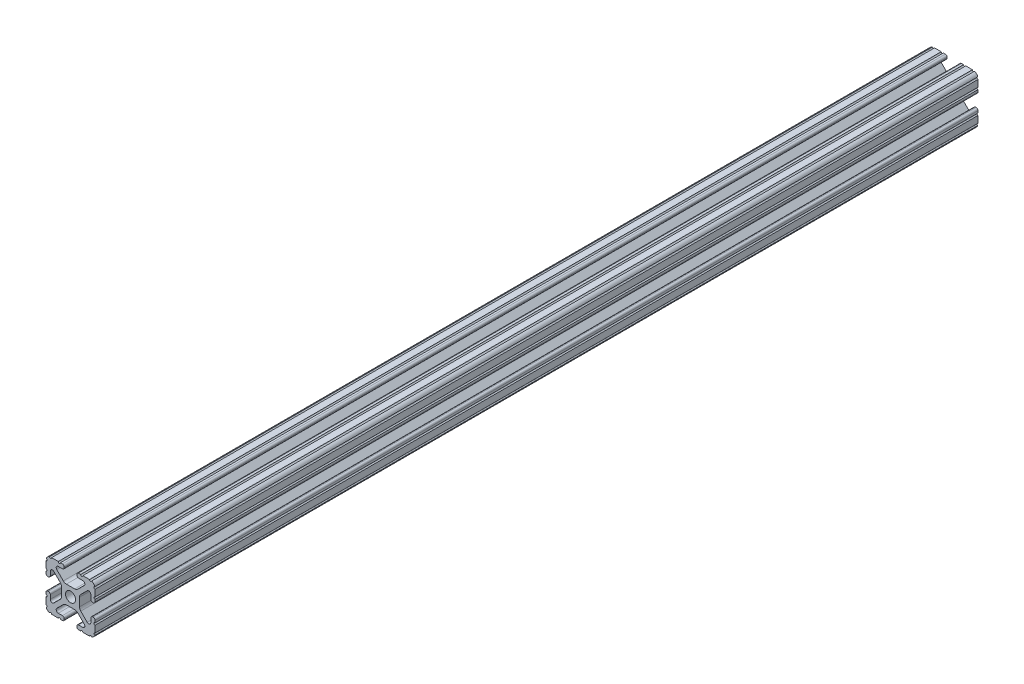
from build123d import *

# Parameters (mm, degrees)
BOSS_EXTRUDE1_DEPTH     = 228.6
CUT_EXTRUDE1_DEPTH      = 230.304470083
CUT_EXTRUDE1_DEPTH_BACK = 230.304470083
SKETCH5_R               = 0.55245


with BuildPart() as part:
    # Sketch4 → Boss-Extrude1 (new, symmetric)
    with BuildSketch(Plane.XY):
        with BuildLine():
            Line((4.190365, -12.7), (10.11729625, -12.7))
            ThreePointArc((10.11729625, -12.7), (11.943543585, -11.943543585), (12.7, -10.11729625))
            Line((12.7, -10.11729625), (12.7, -4.190365))
            ThreePointArc((12.7, -4.190365), (12.42492494, -3.52627506), (11.760835, -3.2512))
            Line((11.760835, -3.2512), (11.429365, -3.2512))
            ThreePointArc((11.429365, -3.2512), (10.76527506, -3.52627506), (10.4902, -4.190365))
            Line((10.4902, -4.190365), (10.4902, -6.348478019))
            ThreePointArc((10.4902, -6.348478019), (9.830707141, -7.335478831), (8.666460301, -7.103895736))
            Line((8.666460301, -7.103895736), (5.299899128, -3.737334563))
            ThreePointArc((5.299899128, -3.737334563), (4.817571085, -3.015479634), (4.6482, -2.16399369))
            Line((4.6482, -2.16399369), (4.6482, 0))
            Line((4.6482, 0), (2.6035, 0))
            ThreePointArc((2.6035, 0), (1.840952505, -1.840952505), (0, -2.6035))
            Line((0, -2.6035), (0, -4.6482))
            Line((0, -4.6482), (2.16399369, -4.6482))
            ThreePointArc((2.16399369, -4.6482), (3.015479634, -4.817571085), (3.737334563, -5.299899128))
            Line((3.737334563, -5.299899128), (7.103895736, -8.666460301))
            ThreePointArc((7.103895736, -8.666460301), (7.335478831, -9.830707141), (6.348478019, -10.4902))
            Line((6.348478019, -10.4902), (4.190365, -10.4902))
            ThreePointArc((4.190365, -10.4902), (3.52627506, -10.76527506), (3.2512, -11.429365))
            Line((3.2512, -11.429365), (3.2512, -11.760835))
            ThreePointArc((3.2512, -11.760835), (3.52627506, -12.42492494), (4.190365, -12.7))
        make_face()
    extrude(amount=BOSS_EXTRUDE1_DEPTH, both=True)

    # Sketch5 → Cut-Extrude1 (cut, two sides: drawn at the far end of the back side and taken through both)
    with BuildSketch(Plane.XY.offset(-CUT_EXTRUDE1_DEPTH_BACK)):
        with Locations((10.356153152, -12.7)):
            Circle(SKETCH5_R)
        with Locations((5.796028019, -12.7)):
            Circle(SKETCH5_R)
        with Locations((12.7, -10.356153152)):
            Circle(SKETCH5_R)
        with Locations((12.7, -5.796028019)):
            Circle(SKETCH5_R)
    extrude(amount=CUT_EXTRUDE1_DEPTH + CUT_EXTRUDE1_DEPTH_BACK, mode=Mode.SUBTRACT)

    # Mirror1: part across plane


with BuildPart() as part_1:
    add(part.part)
    add(part.part.mirror(Plane(origin=(0, 0, 0), x_dir=(0, 0, 1), z_dir=(1, 0, 0))))

    # Mirror2: part across plane


with BuildPart() as part_2:
    add(part_1.part)
    add(part_1.part.mirror(Plane.ZX))


solid = part_2.part
